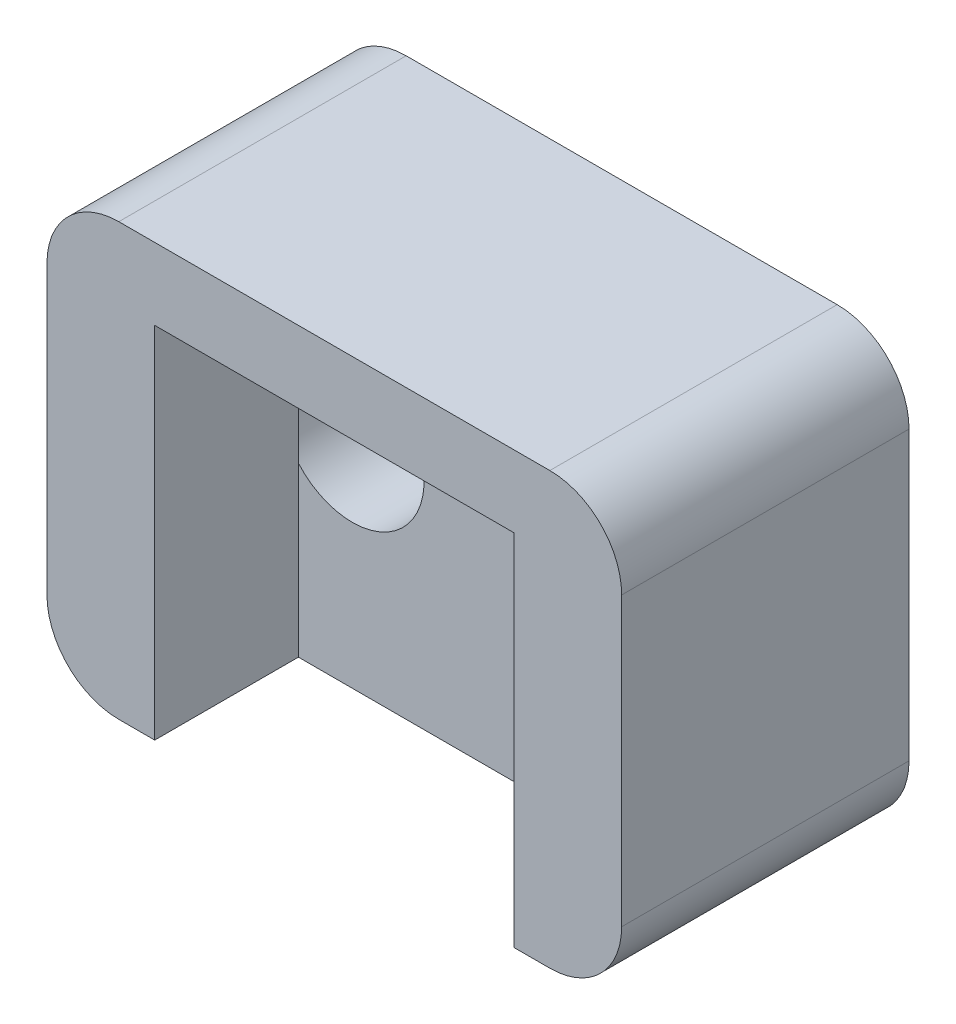
from build123d import *

# Parameters (mm, degrees)
SKETCH1_W           = 40
SKETCH1_H           = 30
BOSS_EXTRUDE1_DEPTH = 20
FILLET1_R           = 5
SKETCH2_R           = 5
CUT_EXTRUDE1_DEPTH  = 10
SKETCH3_W           = 25
SKETCH3_H           = 25
CUT_EXTRUDE2_DEPTH  = 10


with BuildPart() as part:
    # Sketch1 → Boss-Extrude1 (new body)
    with BuildSketch(Plane.XY):
        Rectangle(SKETCH1_W, SKETCH1_H)
    extrude(amount=BOSS_EXTRUDE1_DEPTH)

    # Fillet1
    fillet1_edges = [part.edges().sort_by_distance(p)[0] for p in [
        (20, -15, 10),
        (-20, -15, 10),
        (-20, 15, 10),
        (20, 15, 10),
    ]]
    fillet(fillet1_edges, radius=FILLET1_R)

    # Sketch2 → Cut-Extrude1 (cut)
    with BuildSketch(Plane(origin=(0, 0, 0), x_dir=(-1, 0, 0), z_dir=(0, 0, -1))):
        with Locations((-8.75, 0)):
            Circle(SKETCH2_R)
        with Locations((8.75, 0)):
            Circle(SKETCH2_R)
    extrude(amount=-CUT_EXTRUDE1_DEPTH, mode=Mode.SUBTRACT)

    # Sketch3 → Cut-Extrude2 (cut)
    with BuildSketch(Plane.XY.offset(20)):
        with Locations((0, -2.5)):
            Rectangle(SKETCH3_W, SKETCH3_H)
    extrude(amount=-CUT_EXTRUDE2_DEPTH, mode=Mode.SUBTRACT)


solid = part.part
